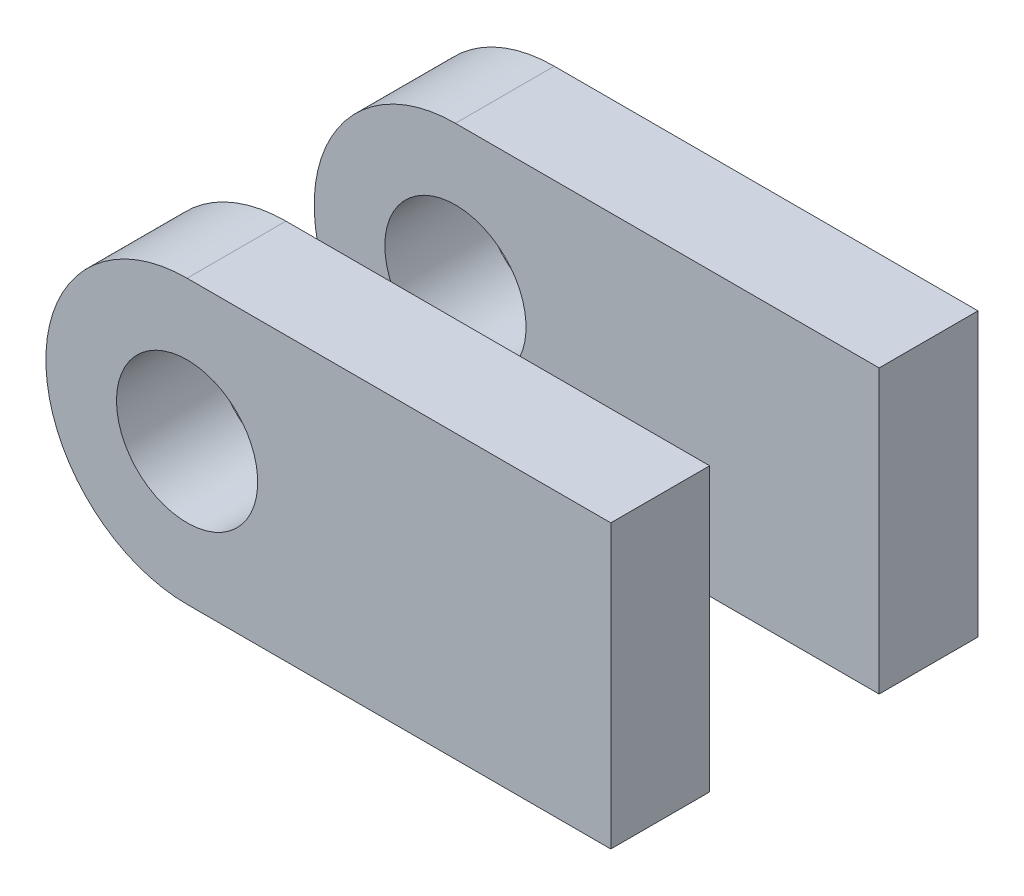
from build123d import *

# Parameters (mm, degrees)
SKETCH7_W             = 40
SKETCH7_H             = 7
BOSS_EXTRUDE3_DEPTH   = 20
BOSS_EXTRUDE3_2_DEPTH = 20
CUT_EXTRUDE9_DEPTH    = 26
SKETCH9_R             = 5
CUT_EXTRUDE10_DEPTH   = 26


with BuildPart() as part:
    # Sketch7 → Boss-Extrude3 (new body)
    with BuildSketch(Plane(origin=(0, 0, 0), x_dir=(1, 0, 0), z_dir=(0, 1, 0))):
        with Locations((20, 9.5)):
            Rectangle(SKETCH7_W, SKETCH7_H)
    extrude(amount=BOSS_EXTRUDE3_DEPTH)


with BuildPart() as body_2:
    # Sketch7 → Boss-Extrude3 2 (new body)
    with BuildSketch(Plane(origin=(0, 0, 0), x_dir=(1, 0, 0), z_dir=(0, 1, 0))):
        with Locations((20, -9.5)):
            Rectangle(SKETCH7_W, SKETCH7_H)
    extrude(amount=BOSS_EXTRUDE3_2_DEPTH)


with BuildPart() as cut_extrude9_tool:
    # Sketch8 → Cut-Extrude9 (new body)
    with BuildSketch(Plane(origin=(0, 0, -13), x_dir=(-1, 0, 0), z_dir=(0, 0, -1))):
        with BuildLine():
            Line((-10, 20), (6.269101311, 20))
            Line((6.269101311, 20), (6.269101311, 0))
            Line((6.269101311, 0), (-10, 0))
            ThreePointArc((-10, 0), (0, 10), (-10, 20))
        make_face()
    extrude(amount=-CUT_EXTRUDE9_DEPTH)


with BuildPart() as part_1:
    add(part.part)

    # Cut-Extrude9: cut by cut_extrude9_tool
    add(cut_extrude9_tool.part, mode=Mode.SUBTRACT)


with BuildPart() as body_2_1:
    add(body_2.part)

    # Cut-Extrude9: cut by cut_extrude9_tool
    add(cut_extrude9_tool.part, mode=Mode.SUBTRACT)


with BuildPart() as cut_extrude10_tool:
    # Sketch9 → Cut-Extrude10 (new body)
    with BuildSketch(Plane(origin=(0, 0, -13), x_dir=(-1, 0, 0), z_dir=(0, 0, -1))):
        with Locations((-10, 10)):
            Circle(SKETCH9_R)
    extrude(amount=-CUT_EXTRUDE10_DEPTH)


with BuildPart() as part_2:
    add(part_1.part)

    # Cut-Extrude10: cut by cut_extrude10_tool
    add(cut_extrude10_tool.part, mode=Mode.SUBTRACT)


with BuildPart() as body_2_2:
    add(body_2_1.part)

    # Cut-Extrude10: cut by cut_extrude10_tool
    add(cut_extrude10_tool.part, mode=Mode.SUBTRACT)


solid = Compound([part_2.part, body_2_2.part])
